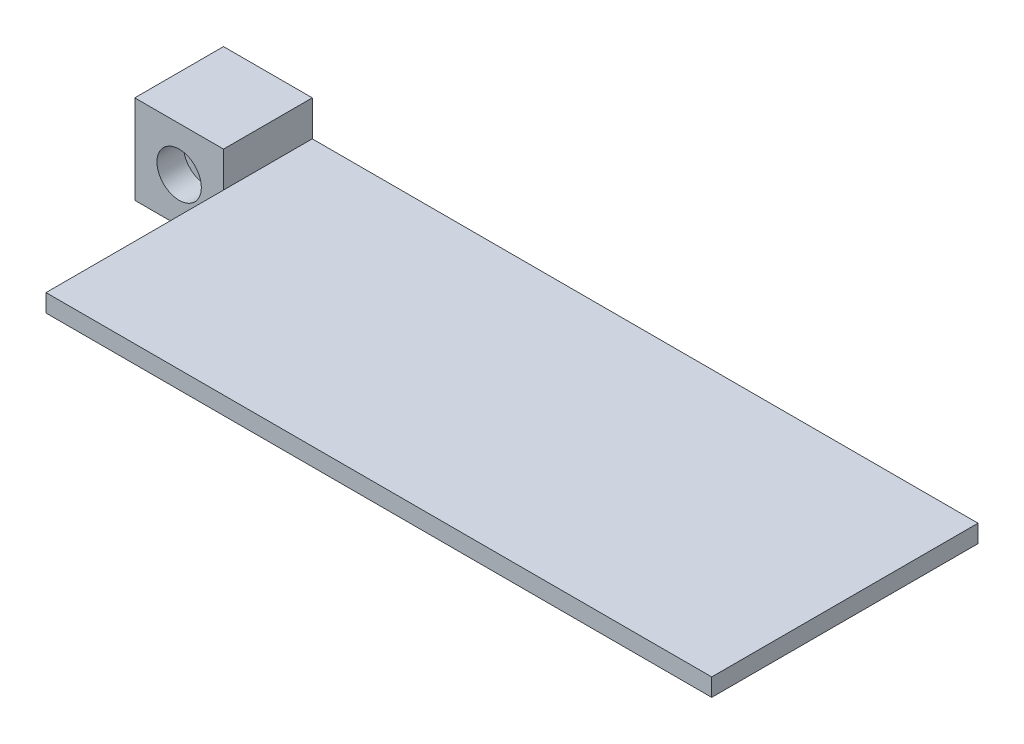
from build123d import *

# Parameters (mm, degrees)
SKETCH1_W           = 85
SKETCH1_H           = 30
BOSS_EXTRUDE1_DEPTH = 30
CUT_EXTRUDE1_DEPTH  = 30
SKETCH3_W           = 10
SKETCH3_H           = 10
CUT_EXTRUDE2_DEPTH  = 20
SKETCH4_R           = 2.5
CUT_EXTRUDE3_DEPTH  = 4
CUT_EXTRUDE4_START  = -3
SKETCH5_R           = 2.5
CUT_EXTRUDE4_DEPTH  = 3
SKETCH6_R           = 1
CUT_EXTRUDE5_DEPTH  = 50.348252249


with BuildPart() as part:
    # Sketch1 → Boss-Extrude1 (new body)
    with BuildSketch(Plane.XY):
        Rectangle(SKETCH1_W, SKETCH1_H)
    extrude(amount=BOSS_EXTRUDE1_DEPTH)

    # Sketch2 → Cut-Extrude1 (cut)
    with BuildSketch(Plane.XY.offset(30)):
        Polygon((-42.5, 0), (-32.5, 0), (-32.5, -4), (42.5, -4), (42.5, 15), (-42.5, 15), align=None)
        Polygon((-42.5, -10), (-32.5, -10), (-32.5, -6), (42.5, -6), (42.5, -15), (-42.5, -15), align=None)
    extrude(amount=-CUT_EXTRUDE1_DEPTH, mode=Mode.SUBTRACT)

    # Sketch3 → Cut-Extrude2 (cut)
    with BuildSketch(Plane.XY.offset(30)):
        with Locations((-37.5, -5)):
            Rectangle(SKETCH3_W, SKETCH3_H)
    extrude(amount=-CUT_EXTRUDE2_DEPTH, mode=Mode.SUBTRACT)

    # Sketch4 → Cut-Extrude3 (cut)
    with BuildSketch(Plane(origin=(0, 0, 0), x_dir=(-1, 0, 0), z_dir=(0, 0, -1))):
        with Locations((37.5, -5)):
            Circle(SKETCH4_R)
    extrude(amount=-CUT_EXTRUDE3_DEPTH, mode=Mode.SUBTRACT)

    # Sketch5 → Cut-Extrude4 (cut)
    with BuildSketch(Plane.XY.offset(10).offset(CUT_EXTRUDE4_START)):
        with Locations(Location((-37.5, -5, 0), (0, 0, 180))):
            Circle(SKETCH5_R)
    extrude(amount=CUT_EXTRUDE4_DEPTH, mode=Mode.SUBTRACT)

    # Sketch6 → Cut-Extrude5 (cut, through all)
    with BuildSketch(Plane.XY.offset(7)):
        with Locations((-37.5, -5)):
            Circle(SKETCH6_R)
    extrude(amount=-CUT_EXTRUDE5_DEPTH, mode=Mode.SUBTRACT)


solid = part.part
